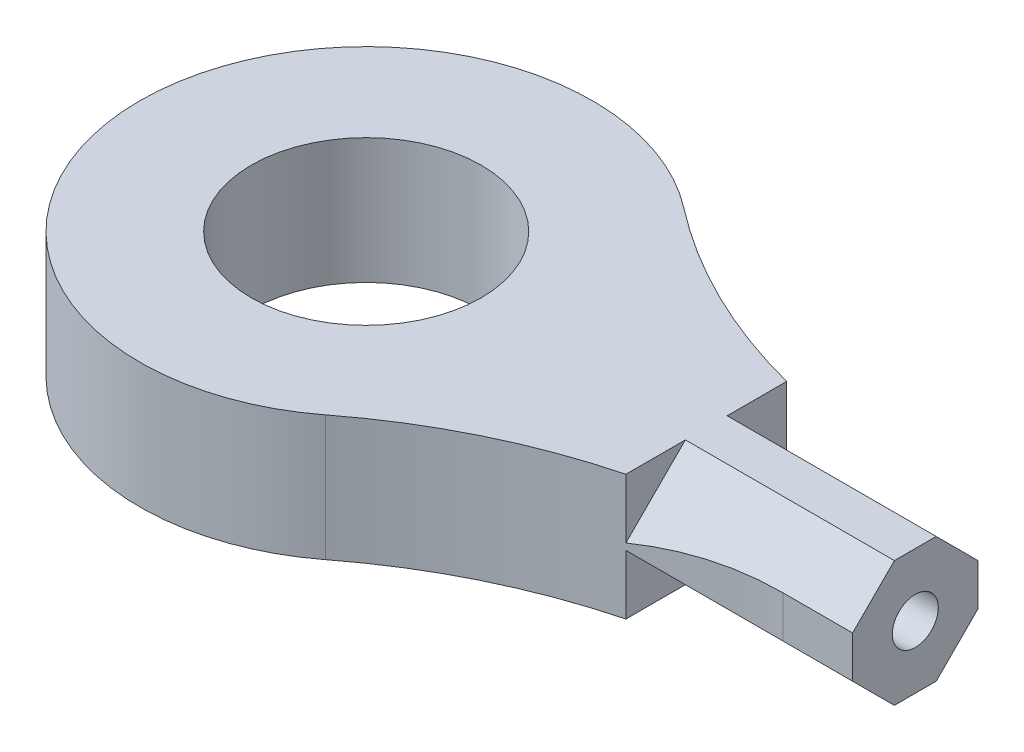
from build123d import *

# Parameters (mm, degrees)
SKETCH1_R                 = 8.25
BOSS_EXTRUDE1_DEPTH       = 9
M4X0_7_TAPPED_HOLE1_D     = 3.3
M4X0_7_TAPPED_HOLE1_DEPTH = 11
M4X0_7_TAPPED_HOLE1_TIP   = 0.991420021
CUT_EXTRUDE4_DEPTH        = 15


with BuildPart() as part:
    # Sketch1 → Boss-Extrude1 (new body)
    with BuildSketch(Plane(origin=(0, 0, 0), x_dir=(1, 0, 0), z_dir=(0, 1, 0))):
        with BuildLine():
            Line((39.406576406, 4.5), (39.406576406, -4.5))
            Line((39.406576406, -4.5), (34.406576406, -4.5))
            ThreePointArc((34.406576406, -4.5), (21.47943012, -6.646481156), (9.939677628, -12.855555556))
            ThreePointArc((9.939677628, -12.855555556), (-16.25, 0), (9.939677628, 12.855555556))
            ThreePointArc((9.939677628, 12.855555556), (21.47943012, 6.646481156), (34.406576406, 4.5))
            Line((34.406576406, 4.5), (39.406576406, 4.5))
        make_face()
        with Locations(Location((0, 0, 0), (0, 0, 270))):
            Circle(SKETCH1_R, mode=Mode.SUBTRACT)
    extrude(amount=BOSS_EXTRUDE1_DEPTH)

    # M4x0.7 Tapped Hole1
    with Locations(Plane(origin=(39.406576406, 0, 0), x_dir=(0, 0, -1), z_dir=(1, 0, 0))):
        with Locations((0, 4.5)):
            Hole(M4X0_7_TAPPED_HOLE1_D / 2, depth=M4X0_7_TAPPED_HOLE1_DEPTH)
            with Locations((0, 0, -(M4X0_7_TAPPED_HOLE1_DEPTH + M4X0_7_TAPPED_HOLE1_TIP / 2))):  # 118° drill point
                Cone(0, M4X0_7_TAPPED_HOLE1_D / 2, M4X0_7_TAPPED_HOLE1_TIP, mode=Mode.SUBTRACT)

    # Sketch11 → Cut-Extrude4 (cut)
    with BuildSketch(Plane(origin=(39.406576406, 0, 0), x_dir=(0, 0, -1), z_dir=(1, 0, 0))):
        Polygon((-1.5, 9), (0, 10.5), (-6, 10.5), (-6, 4.5), (-4.5, 6), (-4.5, 9), align=None)
        Polygon((-4.5, 6), (-1.5, 9), (-4.5, 9), align=None)
        Polygon((6, 10.5), (0, 10.5), (1.5, 9), (4.5, 9), (4.5, 6), (6, 4.5), align=None)
        Polygon((4.5, 9), (1.5, 9), (4.5, 6), align=None)
        Polygon((4.5, 0), (4.5, 3), (1.5, 0), align=None)
        Polygon((6, -1.5), (6, 4.5), (4.5, 3), (4.5, 0), (1.5, 0), (0, -1.5), align=None)
        Polygon((-1.5, 0), (-4.5, 3), (-4.5, 0), align=None)
        Polygon((-4.5, 3), (-6, 4.5), (-6, -1.5), (0, -1.5), (-1.5, 0), (-4.5, 0), align=None)
    extrude(amount=-CUT_EXTRUDE4_DEPTH, mode=Mode.SUBTRACT)


solid = part.part
